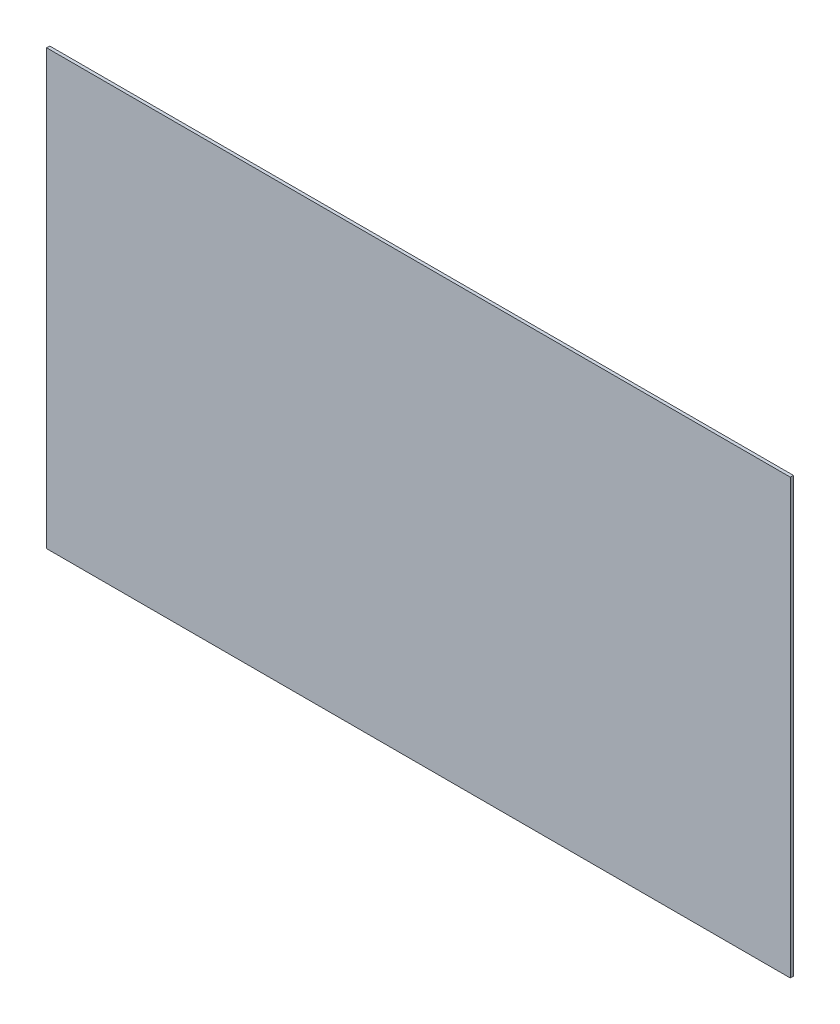
from build123d import *

# Parameters (mm, degrees)
SKETCH1_W           = 720
SKETCH1_H           = 420
BOSS_EXTRUDE1_DEPTH = 3


with BuildPart() as part:
    # Sketch1 → Boss-Extrude1 (new body)
    with BuildSketch(Plane.XY):
        Rectangle(SKETCH1_W, SKETCH1_H)
    extrude(amount=BOSS_EXTRUDE1_DEPTH)


solid = part.part
